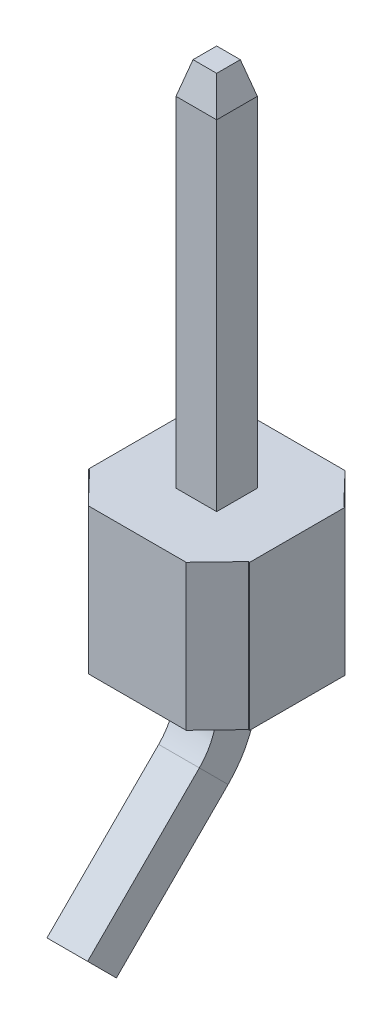
from build123d import *
from OCP.BRepFilletAPI import BRepFilletAPI_MakeChamfer

# Parameters (mm, degrees)
BOSS_EXTRUDE1_DEPTH = 2.29
SKETCH3_W           = 0.64
SKETCH3_H           = 0.64
CHAMFER3_SIZE       = 0.5
CHAMFER3_SIZE2      = 0.133974596


with BuildPart() as part:
    # Sketch1 → Boss-Extrude1 (new body)
    with BuildSketch(Plane(origin=(0, 0, 0), x_dir=(1, 0, 0), z_dir=(0, 1, 0))):
        Polygon((-0.77, 1.25), (0.77, 1.25), (1.25, 0.75), (1.27, 0.75), (1.27, -0.75), (1.25, -0.75), (0.77, -1.25), (-0.77, -1.25), (-1.25, -0.75), (-1.27, -0.75), (-1.27, 0.75), (-1.25, 0.75), align=None)
    extrude(amount=BOSS_EXTRUDE1_DEPTH)

    # Sweep1: sweep along a path in Sketch2
    with BuildLine(Plane(origin=(0, 0, 0), x_dir=(0, 0, -1), z_dir=(1, 0, 0))) as sweep1_path:
        Line((0, 8.13), (0, -0.408142235))
        ThreePointArc((0, -0.408142235), (-0.095150584, -0.886496526), (-0.366116524, -1.292025712))
        Line((-0.366116524, -1.292025712), (-2.124090812, -3.05))
    # Sketch3 → Sweep1 (sweep)
    with BuildSketch(Plane(origin=(0, 8.13, 0), x_dir=(1, 0, 0), z_dir=(0, 1, 0))):
        Rectangle(SKETCH3_W, SKETCH3_H)
    sweep(path=sweep1_path.line)

    # Chamfer3: one chamfer whose edges measure the first distance from different faces: ONE call of the kernel's chamfer builder (chamfer() names one face for all edges)
    chamfer3_edges_1 = [part.edges().sort_by_distance(p)[0] for p in [
        (0.32, 8.13, 0),
    ]]
    chamfer3_side_1 = [part.faces().sort_by_distance(p)[0] for p in [
        (0.32, 5.21, 0),
    ]]
    chamfer3_edges_2 = [part.edges().sort_by_distance(p)[0] for p in [
        (0, 8.13, -0.32),
    ]]
    chamfer3_side_2 = [part.faces().sort_by_distance(p)[0] for p in [
        (0, 5.21, -0.32),
    ]]
    chamfer3_edges_3 = [part.edges().sort_by_distance(p)[0] for p in [
        (-0.32, 8.13, 0),
    ]]
    chamfer3_side_3 = [part.faces().sort_by_distance(p)[0] for p in [
        (-0.32, 5.21, 0),
    ]]
    chamfer3_edges_4 = [part.edges().sort_by_distance(p)[0] for p in [
        (0, 8.13, 0.32),
    ]]
    chamfer3_side_4 = [part.faces().sort_by_distance(p)[0] for p in [
        (0, 5.21, 0.32),
    ]]
    chamfer3 = BRepFilletAPI_MakeChamfer(part.part.solid().wrapped)
    for e in chamfer3_edges_1:
        chamfer3.Add(CHAMFER3_SIZE, CHAMFER3_SIZE2, e.wrapped, chamfer3_side_1[0].wrapped)  # the first distance lies on this face
    for e in chamfer3_edges_2:
        chamfer3.Add(CHAMFER3_SIZE, CHAMFER3_SIZE2, e.wrapped, chamfer3_side_2[0].wrapped)  # the first distance lies on this face
    for e in chamfer3_edges_3:
        chamfer3.Add(CHAMFER3_SIZE, CHAMFER3_SIZE2, e.wrapped, chamfer3_side_3[0].wrapped)  # the first distance lies on this face
    for e in chamfer3_edges_4:
        chamfer3.Add(CHAMFER3_SIZE, CHAMFER3_SIZE2, e.wrapped, chamfer3_side_4[0].wrapped)  # the first distance lies on this face
    add(Compound.cast(chamfer3.Shape()), mode=Mode.REPLACE)


solid = part.part
